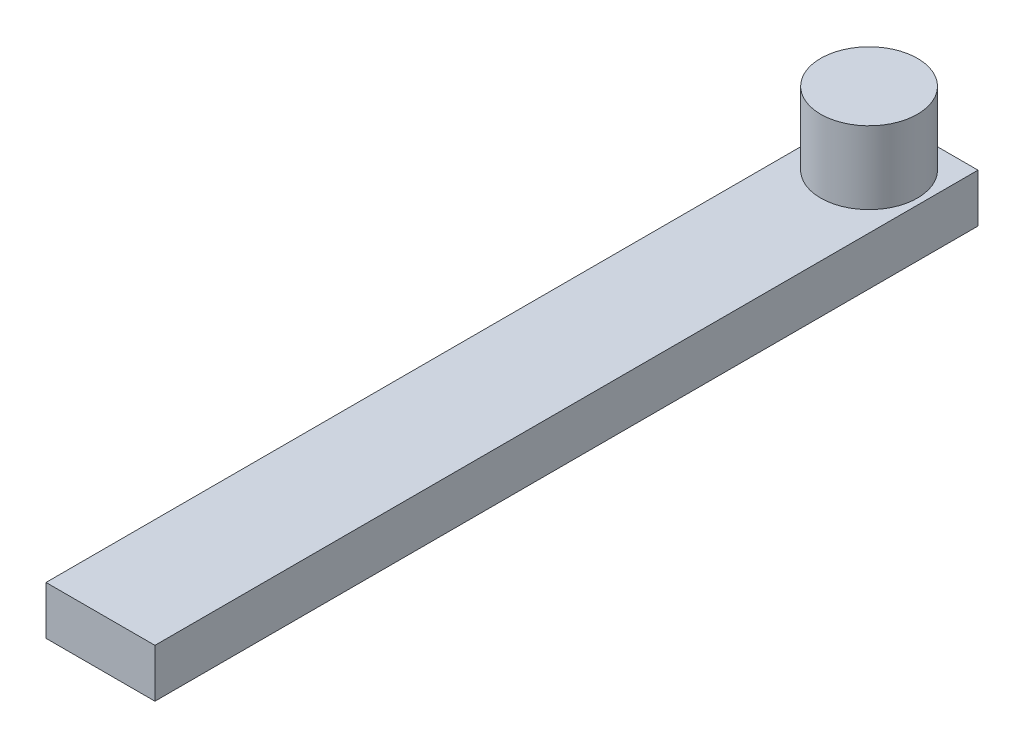
from build123d import *

# Parameters (mm, degrees)
CROQUIS1_W              = 45
CROQUIS1_H              = 340
SALIENTE_EXTRUIR1_DEPTH = 20
CROQUIS2_R              = 20
SALIENTE_EXTRUIR2_DEPTH = 30


with BuildPart() as part:
    # Croquis1 → Saliente-Extruir1 (new body)
    with BuildSketch(Plane(origin=(0, 0, 0), x_dir=(1, 0, 0), z_dir=(0, 1, 0))):
        with Locations((22.5, 230)):
            Rectangle(CROQUIS1_W, CROQUIS1_H)
    extrude(amount=SALIENTE_EXTRUIR1_DEPTH)

    # Croquis2 → Saliente-Extruir2 (add)
    with BuildSketch(Plane(origin=(0, 20, 0), x_dir=(1, 0, 0), z_dir=(0, 1, 0))):
        with Locations(Location((22.5, 377.5, 0), (0, 0, 270))):
            Circle(CROQUIS2_R)
    extrude(amount=SALIENTE_EXTRUIR2_DEPTH)


solid = part.part
